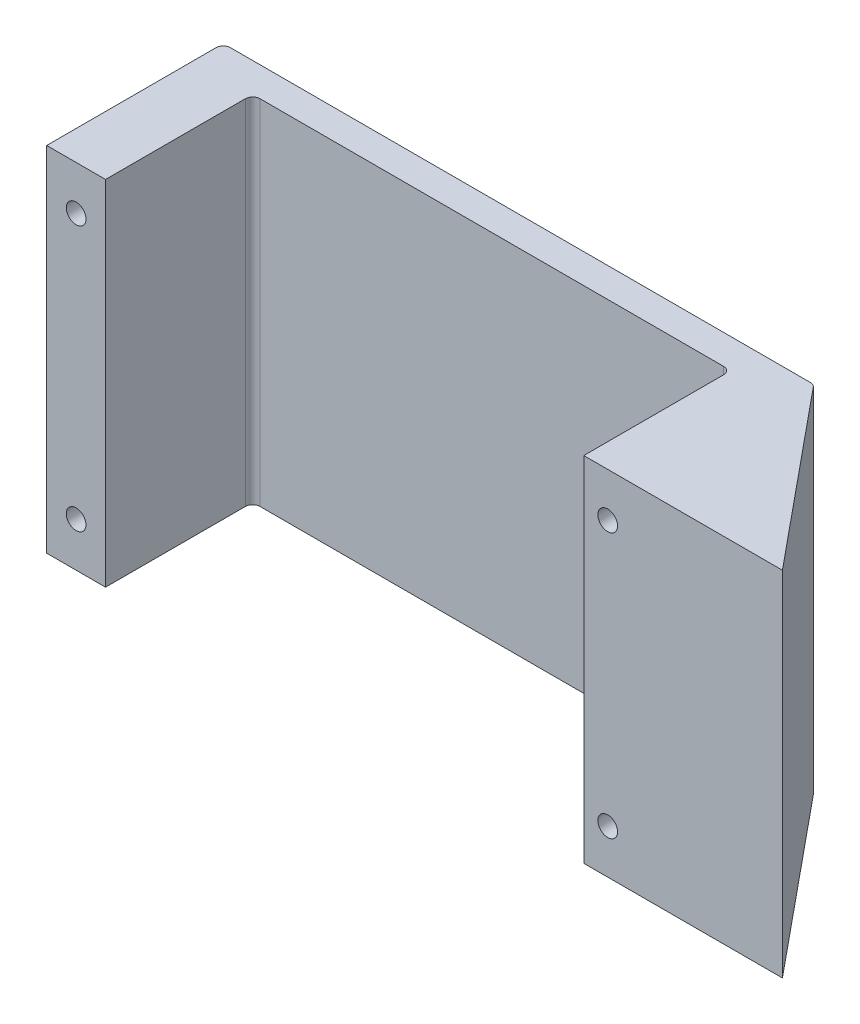
from build123d import *

# Parameters (mm, degrees)
BOSS_EXTRUDE1_DEPTH                           = 20.32
BOSS_EXTRUDE1_DEPTH_BACK                      = 40.64
CBORE_FOR_M3_PAN_HEAD_MACHINE_SCREW1_AT_COUNT = 2
CBORE_FOR_M3_PAN_HEAD_MACHINE_SCREW1_AT_PITCH = 91.768246806
CBORE_FOR_M3_PAN_HEAD_MACHINE_SCREW1_2_COUNT  = 2
CBORE_FOR_M3_PAN_HEAD_MACHINE_SCREW1_2_PITCH  = 102.526725891
CBORE_FOR_M3_PAN_HEAD_MACHINE_SCREW1_3_COUNT  = 2
CBORE_FOR_M3_PAN_HEAD_MACHINE_SCREW1_3_PITCH  = 45.72
FILLET1_R                                     = 1.27


with BuildPart() as part:
    # Sketch1 → Boss-Extrude1 (new, two sides: drawn at the far end of the back side and taken through both)
    with BuildSketch(Plane(origin=(0, 0, 0), x_dir=(1, 0, 0), z_dir=(0, 1, 0)).offset(-BOSS_EXTRUDE1_DEPTH_BACK)):
        Polygon((-52.827899024, -76.979185495), (-62.987899024, -76.979185495), (-62.987899024, -46.499185495), (38.940347782, -46.499185495), (64.012100976, -76.979185495), (29.722100976, -76.979185495), (29.722100976, -51.579185495), (-52.827899024, -51.579185495), align=None)
    extrude(amount=BOSS_EXTRUDE1_DEPTH + BOSS_EXTRUDE1_DEPTH_BACK)

    # Sketch4 → CBORE for M3 Pan Head Machine Screw1 (revolve, cut)
    with BuildSketch(Plane(origin=(33.860347782, -33.02, 46.499185495), x_dir=(0, 1, 0), z_dir=(1, 0, 0))):
        Polygon((0, 0), (0, 30.48), (1.7, 30.48), (1.7, 2.4), (3.5, 2.4), (3.5, 0.025), (3.525, 0), align=None)
    cbore_for_m3_pan_head_machine_screw1 = revolve(axis=Axis((33.860347782, -33.02, 40.149185495), (0, 0, 1)), mode=Mode.SUBTRACT)

    # CBORE for M3 Pan Head Machine Screw1 at: CBORE for M3 Pan Head Machine Screw1 ×2
    with Locations(*[(-i * CBORE_FOR_M3_PAN_HEAD_MACHINE_SCREW1_AT_PITCH, 0, 0) for i in range(1, CBORE_FOR_M3_PAN_HEAD_MACHINE_SCREW1_AT_COUNT)]):
        add(cbore_for_m3_pan_head_machine_screw1, mode=Mode.SUBTRACT)

    # CBORE for M3 Pan Head Machine Screw1 2: CBORE for M3 Pan Head Machine Screw1 ×2
    with Locations(*[Vector(-0.8950665888221234, 0.4459325078689913, 0) * (i * CBORE_FOR_M3_PAN_HEAD_MACHINE_SCREW1_2_PITCH) for i in range(1, CBORE_FOR_M3_PAN_HEAD_MACHINE_SCREW1_2_COUNT)]):
        add(cbore_for_m3_pan_head_machine_screw1, mode=Mode.SUBTRACT)

    # CBORE for M3 Pan Head Machine Screw1 3: CBORE for M3 Pan Head Machine Screw1 ×2
    with Locations(*[(0, i * CBORE_FOR_M3_PAN_HEAD_MACHINE_SCREW1_3_PITCH, 0) for i in range(1, CBORE_FOR_M3_PAN_HEAD_MACHINE_SCREW1_3_COUNT)]):
        add(cbore_for_m3_pan_head_machine_screw1, mode=Mode.SUBTRACT)

    # Fillet1
    fillet1_edges = [part.edges().sort_by_distance(p)[0] for p in [
        (-62.987899024, -10.16, 46.499185495),
        (38.940347782, -10.16, 46.499185495),
        (29.722100976, -10.16, 51.579185495),
        (-52.827899024, -10.16, 51.579185495),
    ]]
    fillet(fillet1_edges, radius=FILLET1_R)


solid = part.part
